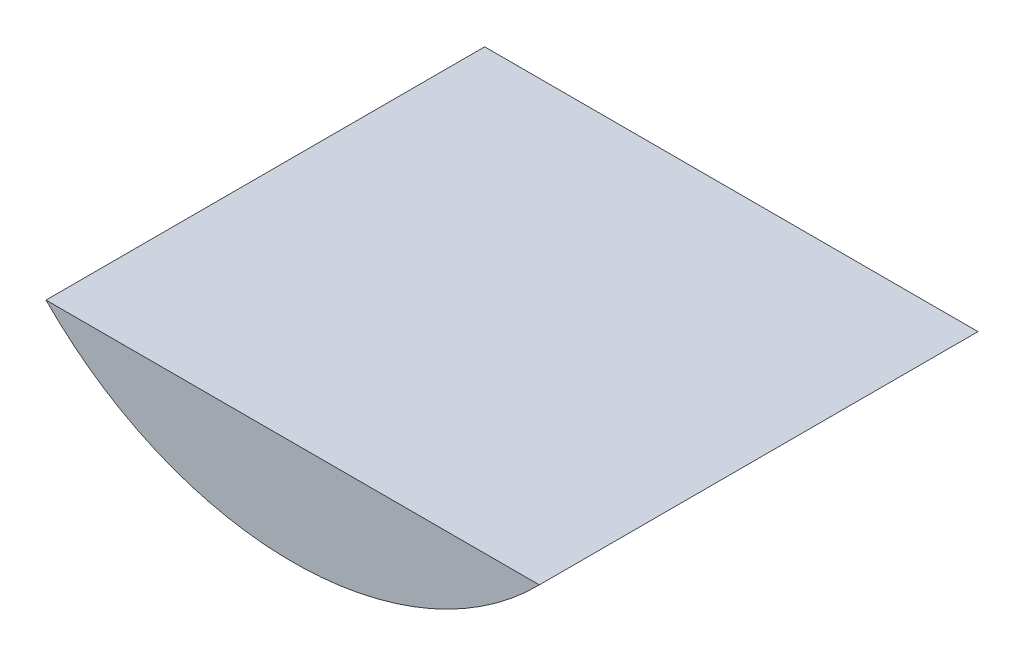
from build123d import *

# Parameters (mm, degrees)
BOSS_EXTRUDE1_DEPTH = 127


with BuildPart() as part:
    # Sketch2 → Boss-Extrude1 (new body)
    with BuildSketch(Plane.XY):
        with BuildLine():
            Line((-71.414284285, -70), (71.414284285, -70))
            ThreePointArc((71.414284285, -70), (0, -100), (-71.414284285, -70))
        make_face()
    extrude(amount=BOSS_EXTRUDE1_DEPTH)


solid = part.part
